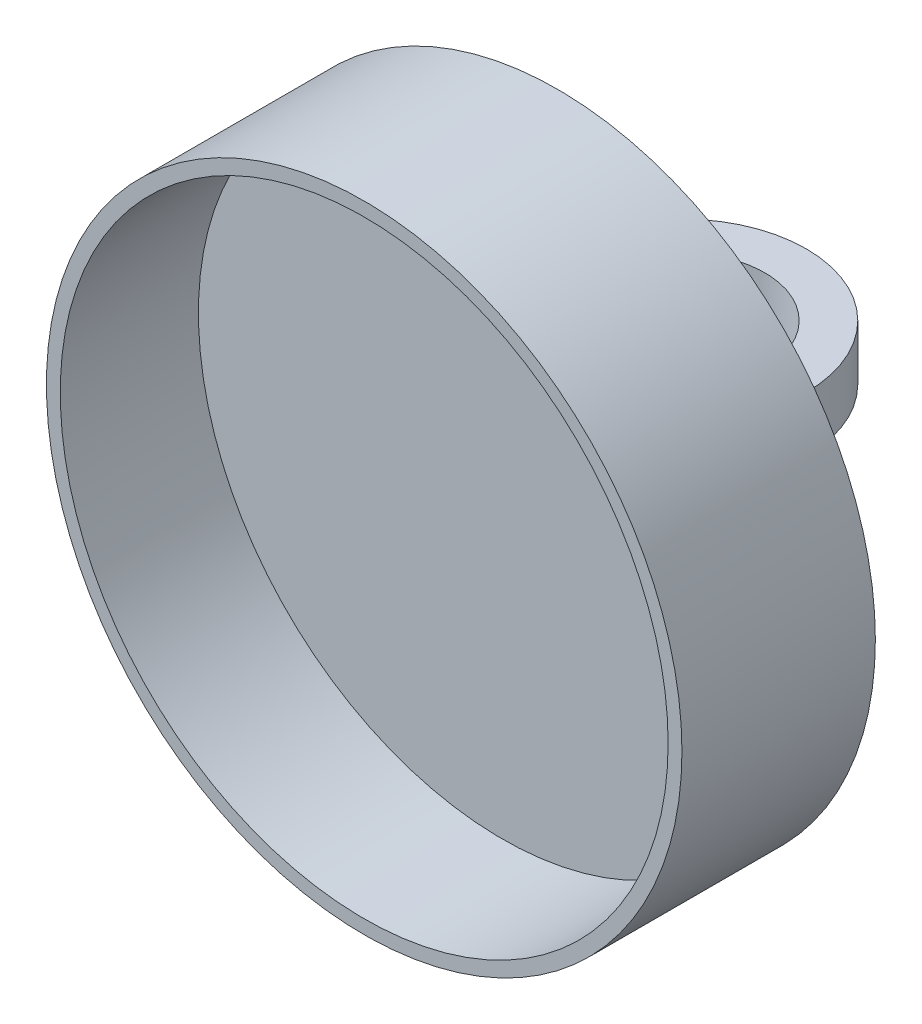
from build123d import *

# Parameters (mm, degrees)
SKETCH1_R           = 11.5
BOSS_EXTRUDE1_DEPTH = 2
SKETCH2_R           = 11.5
SKETCH2_R_2         = 11
BOSS_EXTRUDE2_DEPTH = 5
SKETCH3_R           = 4.5
SKETCH3_R_2         = 3
BOSS_EXTRUDE3_DEPTH = 2


with BuildPart() as part:
    # Sketch1 → Boss-Extrude1 (new body)
    with BuildSketch(Plane.XY):
        Circle(SKETCH1_R)
    extrude(amount=BOSS_EXTRUDE1_DEPTH)

    # Sketch2 → Boss-Extrude2 (add)
    with BuildSketch(Plane.XY.offset(2)):
        Circle(SKETCH2_R)
        Circle(SKETCH2_R_2, mode=Mode.SUBTRACT)
    extrude(amount=BOSS_EXTRUDE2_DEPTH)


with BuildPart() as body_2:
    # Sketch3 → Boss-Extrude3 (new body)
    with BuildSketch(Plane(origin=(0, 0, 0), x_dir=(1, 0, 0), z_dir=(0, 1, 0))):
        with Locations(Location((0, 4.5, 0), (0, 0, 270))):
            Circle(SKETCH3_R)
        with Locations(Location((0, 4.5, 0), (0, 0, 270))):
            Circle(SKETCH3_R_2, mode=Mode.SUBTRACT)
    extrude(amount=BOSS_EXTRUDE3_DEPTH)


solid = Compound([part.part, body_2.part])
